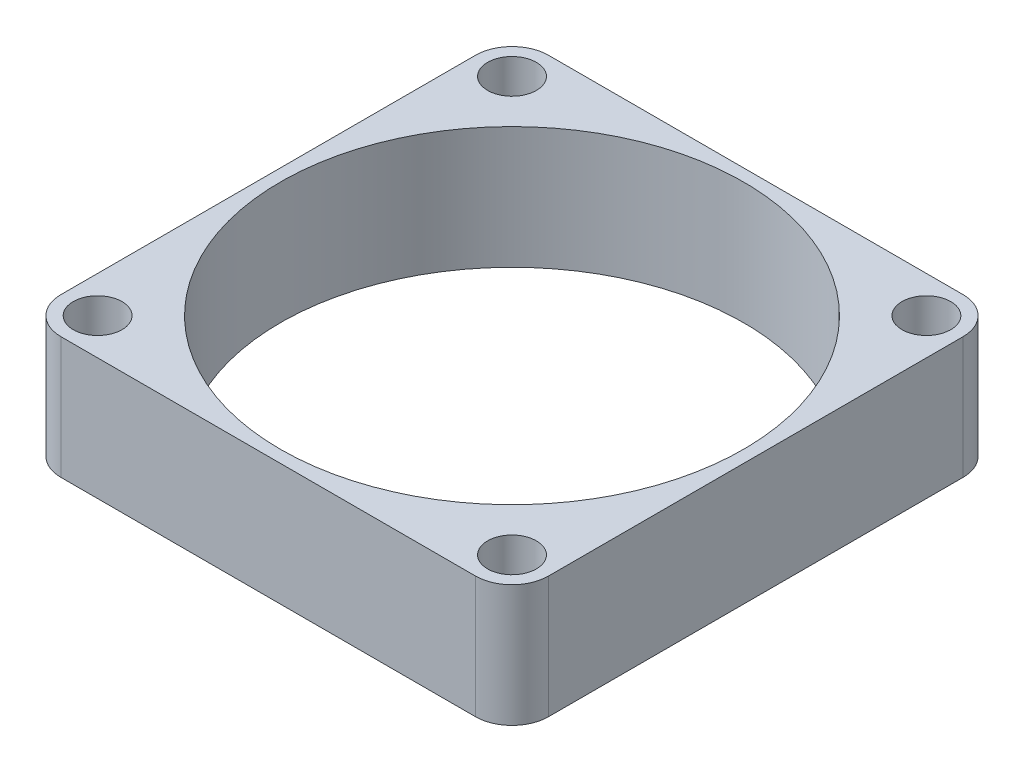
from build123d import *

# Parameters (mm, degrees)
SKETCH1_R           = 19
SKETCH1_R_2         = 2
BOSS_EXTRUDE1_DEPTH = 10


with BuildPart() as part:
    # Sketch1 → Boss-Extrude1 (new body)
    with BuildSketch(Plane(origin=(0, 0, 0), x_dir=(1, 0, 0), z_dir=(0, 1, 0))):
        with BuildLine():
            Line((3, 0), (37, 0))
            ThreePointArc((37, 0), (39.121320344, 0.878679656), (40, 3))
            Line((40, 3), (40, 37))
            ThreePointArc((40, 37), (39.121320344, 39.121320344), (37, 40))
            Line((37, 40), (3, 40))
            ThreePointArc((3, 40), (0.878679656, 39.121320344), (0, 37))
            Line((0, 37), (0, 3))
            ThreePointArc((0, 3), (0.878679656, 0.878679656), (3, 0))
        make_face()
        with Locations(Location((20, 20, 0), (0, 0, 270))):
            Circle(SKETCH1_R, mode=Mode.SUBTRACT)
        with Locations(Location((3, 37, 0), (0, 0, 270))):
            Circle(SKETCH1_R_2, mode=Mode.SUBTRACT)
        with Locations(Location((37, 37, 0), (0, 0, 90))):
            Circle(SKETCH1_R_2, mode=Mode.SUBTRACT)
        with Locations(Location((37, 3, 0), (0, 0, 270))):
            Circle(SKETCH1_R_2, mode=Mode.SUBTRACT)
        with Locations(Location((3, 3, 0), (0, 0, 90))):
            Circle(SKETCH1_R_2, mode=Mode.SUBTRACT)
    extrude(amount=BOSS_EXTRUDE1_DEPTH)


solid = part.part
